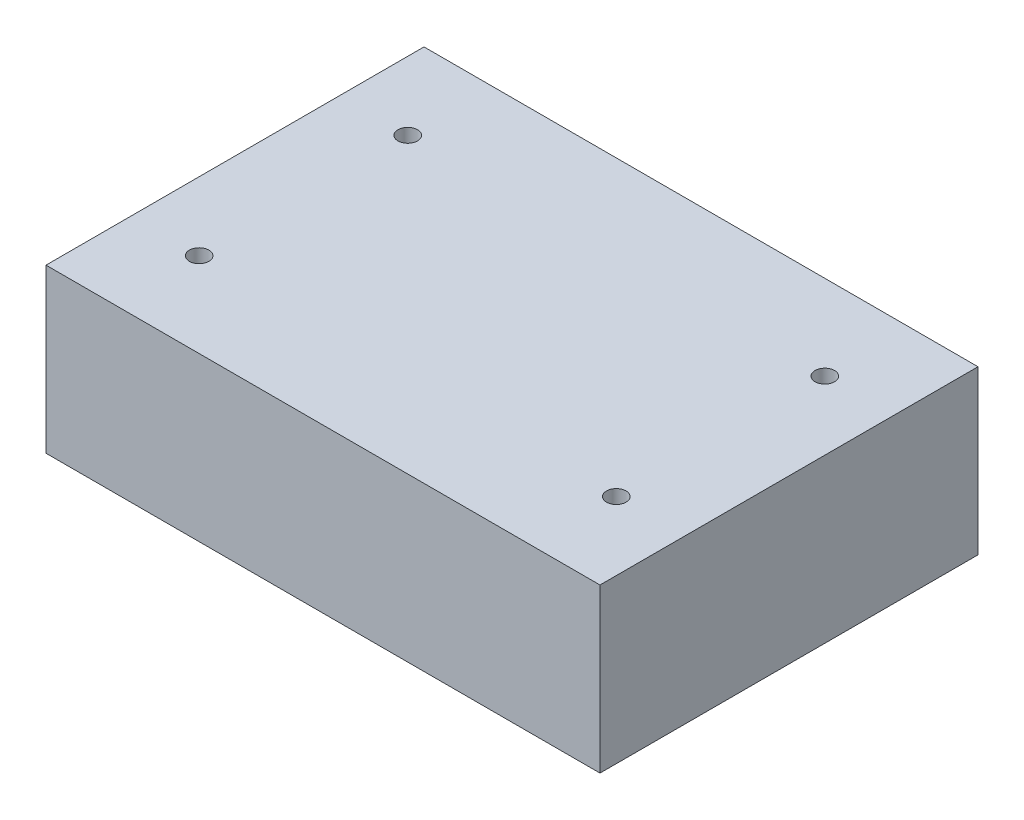
from build123d import *

# Parameters (mm, degrees)
SKETCH1_W           = 85
SKETCH1_H           = 58
SKETCH1_R           = 1.5
BOSS_EXTRUDE1_DEPTH = 25


with BuildPart() as part:
    # Sketch1 → Boss-Extrude1 (new body)
    with BuildSketch(Plane(origin=(0, 0, 0), x_dir=(1, 0, 0), z_dir=(0, 1, 0))):
        with Locations((42.5, 29)):
            Rectangle(SKETCH1_W, SKETCH1_H)
        with Locations(Location((10.5, 45, 0), (0, 0, 270))):
            Circle(SKETCH1_R, mode=Mode.SUBTRACT)
        with Locations(Location((74.5, 45, 0), (0, 0, 90))):
            Circle(SKETCH1_R, mode=Mode.SUBTRACT)
        with Locations(Location((74.5, 13, 0), (0, 0, 270))):
            Circle(SKETCH1_R, mode=Mode.SUBTRACT)
        with Locations(Location((10.5, 13, 0), (0, 0, 90))):
            Circle(SKETCH1_R, mode=Mode.SUBTRACT)
    extrude(amount=BOSS_EXTRUDE1_DEPTH)


solid = part.part
